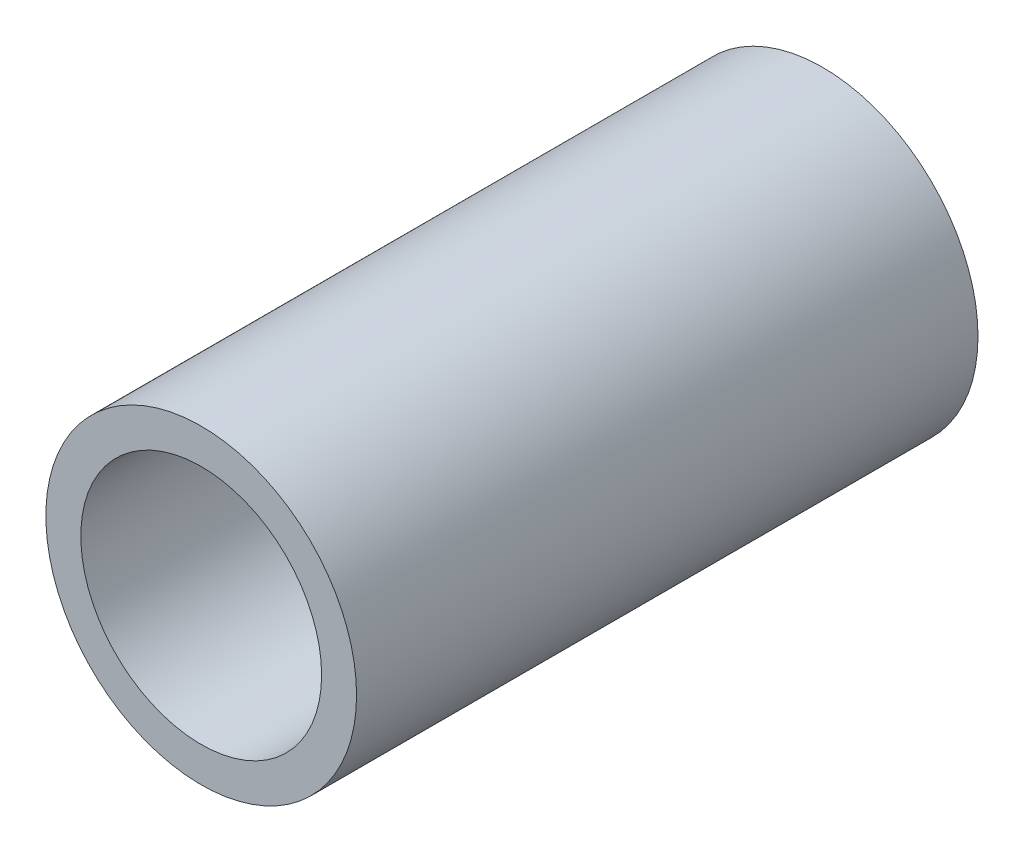
from build123d import *

# Parameters (mm, degrees)
SKETCH_1_R      = 1
SKETCH_1_R_2    = 0.775
EXTRUDE_1_DEPTH = 4


with BuildPart() as part:
    # Эскиз1 → Бобышка-Вытянуть1 (new body)
    with BuildSketch(Plane.XY):
        Circle(SKETCH_1_R)
        Circle(SKETCH_1_R_2, mode=Mode.SUBTRACT)
    extrude(amount=EXTRUDE_1_DEPTH)


solid = part.part
